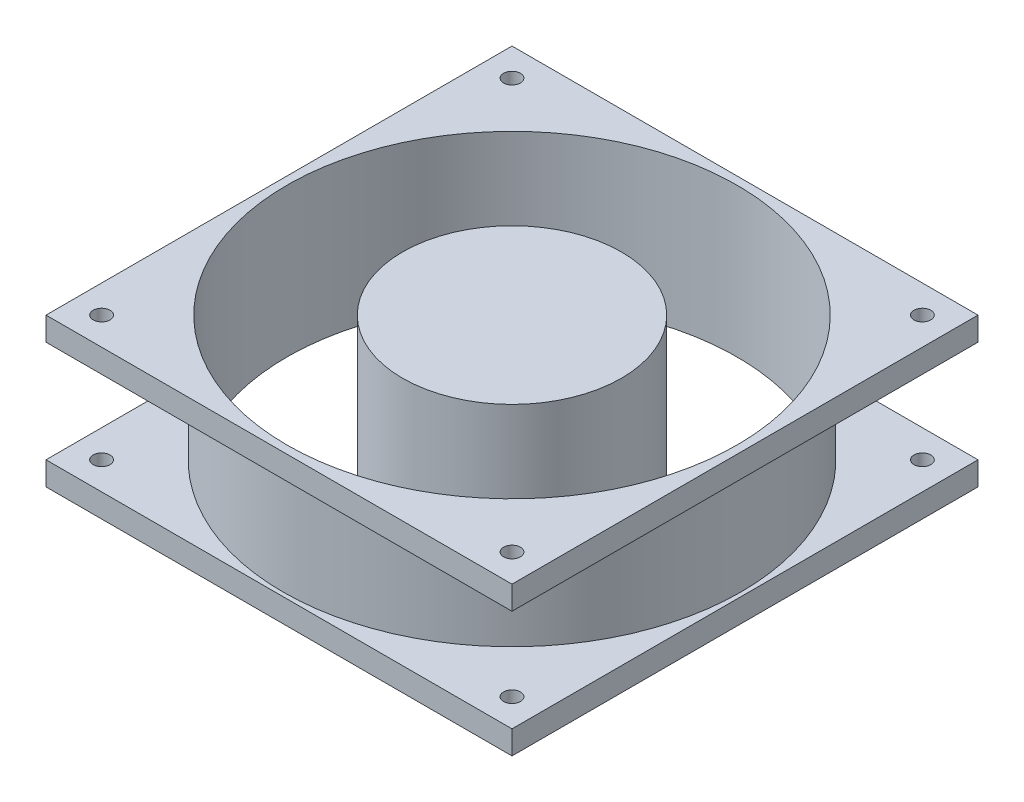
from build123d import *

# Parameters (mm, degrees)
BOSS_EXTRUDE1_START = -19
SKETCH1_W           = 119
SKETCH1_H           = 119
SKETCH1_R           = 57.468
SKETCH1_R_2         = 2.15
BOSS_EXTRUDE1_DEPTH = 6
BOSS_EXTRUDE2_START = -0.1
SKETCH2_R           = 58.484
SKETCH2_R_2         = 57.468
BOSS_EXTRUDE2_DEPTH = 26.2
SKETCH3_R           = 27.94
BOSS_EXTRUDE3_DEPTH = 19


with BuildPart() as part:
    # Sketch1 → Boss-Extrude1 (new body)
    with BuildSketch(Plane(origin=(0, 0, 0), x_dir=(1, 0, 0), z_dir=(0, 1, 0)).offset(BOSS_EXTRUDE1_START)):
        Rectangle(SKETCH1_W, SKETCH1_H)
        with Locations(Location((0, 0, 0), (0, 0, 270))):
            Circle(SKETCH1_R, mode=Mode.SUBTRACT)
        with Locations(Location((-52.4, 52.4, 0), (0, 0, 270))):
            Circle(SKETCH1_R_2, mode=Mode.SUBTRACT)
        with Locations(Location((52.4, 52.4, 0), (0, 0, 270))):
            Circle(SKETCH1_R_2, mode=Mode.SUBTRACT)
        with Locations(Location((52.4, -52.4, 0), (0, 0, 270))):
            Circle(SKETCH1_R_2, mode=Mode.SUBTRACT)
        with Locations(Location((-52.4, -52.4, 0), (0, 0, 270))):
            Circle(SKETCH1_R_2, mode=Mode.SUBTRACT)
    boss_extrude1 = extrude(amount=BOSS_EXTRUDE1_DEPTH)

    # Sketch2 → Boss-Extrude2 (add)
    with BuildSketch(Plane(origin=(0, -13, 0), x_dir=(-1, 0, 0), z_dir=(0, 1, 0)).offset(BOSS_EXTRUDE2_START)):
        with Locations(Location((0, 0, 0), (0, 0, 90))):
            Circle(SKETCH2_R)
        with Locations(Location((0, 0, 0), (0, 0, 90))):
            Circle(SKETCH2_R_2, mode=Mode.SUBTRACT)
    extrude(amount=BOSS_EXTRUDE2_DEPTH)

    # Mirror5: Boss-Extrude1 across plane
    add(boss_extrude1.mirror(Plane.ZX))


with BuildPart() as body_2:
    # Sketch3 → Boss-Extrude3 (new, symmetric)
    with BuildSketch(Plane(origin=(0, 0, 0), x_dir=(1, 0, 0), z_dir=(0, 1, 0))):
        with Locations(Location((0, 0, 0), (0, 0, 270))):
            Circle(SKETCH3_R)
    extrude(amount=BOSS_EXTRUDE3_DEPTH, both=True)


solid = Compound([part.part, body_2.part])
